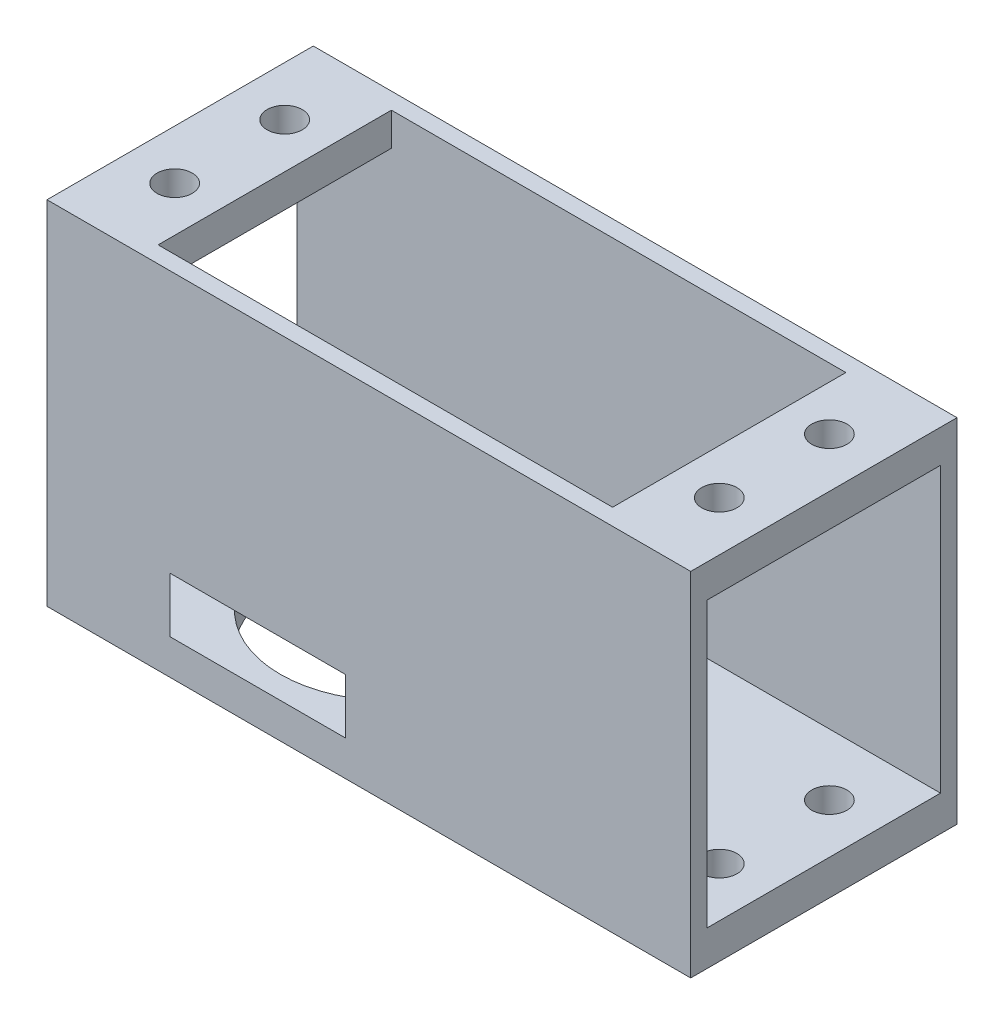
from build123d import *

# Parameters (mm, degrees)
CHANNEL_DEPTH             = 39.35
CHANNEL_DEPTH_BACK        = 19.15
FLANGES_SKETCH_W          = 8.6
FLANGES_SKETCH_H          = 3
FLANGES_DEPTH             = 10.6
SERVO_HOLES_SKETCH_R      = 1.6
SERVO_HOLES_DEPTH         = 54.2
PANEL_HOLE_SKETCH_R       = 10.05
PANEL_HOLE_DEPTH          = 16.4
PANEL_NUT_RELIEF_SKETCH_W = 14.5
PANEL_NUT_RELIEF_SKETCH_H = 5


with BuildPart() as part:
    # Channel Sketch → Channel (new, two sides: drawn at the far end of the back side and taken through both)
    with BuildSketch(Plane(origin=(0, 0, 0), x_dir=(0, 0, -1), z_dir=(1, 0, 0)).offset(-CHANNEL_DEPTH_BACK)):
        Polygon((-12.1, 12.2), (12.1, 12.2), (12.1, 44.2), (10.6, 44.2), (10.6, 15.4), (-10.6, 15.4), (-10.6, 44.2), (-12.1, 44.2), align=None)
    extrude(amount=CHANNEL_DEPTH + CHANNEL_DEPTH_BACK)

    # Flanges Sketch → Flanges (add, symmetric)
    with BuildSketch(Plane.XY):
        with Locations((-14.85, 42.7)):
            Rectangle(FLANGES_SKETCH_W, FLANGES_SKETCH_H)
        with Locations((35.05, 42.7)):
            Rectangle(FLANGES_SKETCH_W, FLANGES_SKETCH_H)
    extrude(amount=FLANGES_DEPTH, both=True)

    # Servo Holes Sketch → Servo Holes (cut, symmetric)
    with BuildSketch(Plane(origin=(0, 0, 0), x_dir=(1, 0, 0), z_dir=(0, 1, 0))):
        with Locations((-14.65, -5)):
            Circle(SERVO_HOLES_SKETCH_R)
        with Locations((-14.65, 5)):
            Circle(SERVO_HOLES_SKETCH_R)
        with Locations((34.85, -5)):
            Circle(SERVO_HOLES_SKETCH_R)
        with Locations((34.85, 5)):
            Circle(SERVO_HOLES_SKETCH_R)
    extrude(amount=SERVO_HOLES_DEPTH, both=True, mode=Mode.SUBTRACT)

    # Panel Hole Sketch → Panel Hole (cut, symmetric)
    with BuildSketch(Plane(origin=(0, 0, 0), x_dir=(1, 0, 0), z_dir=(0, 1, 0))):
        Circle(PANEL_HOLE_SKETCH_R)
    extrude(amount=PANEL_HOLE_DEPTH, both=True, mode=Mode.SUBTRACT)

    # Panel Nut Relief Sketch → Panel Nut Relief (revolve, cut)
    with BuildSketch(Plane.XY):
        with Locations((7.25, 17.9)):
            Rectangle(PANEL_NUT_RELIEF_SKETCH_W, PANEL_NUT_RELIEF_SKETCH_H)
    revolve(axis=Axis((0, -500, 0), (0, 1, 0)), mode=Mode.SUBTRACT)


solid = part.part
